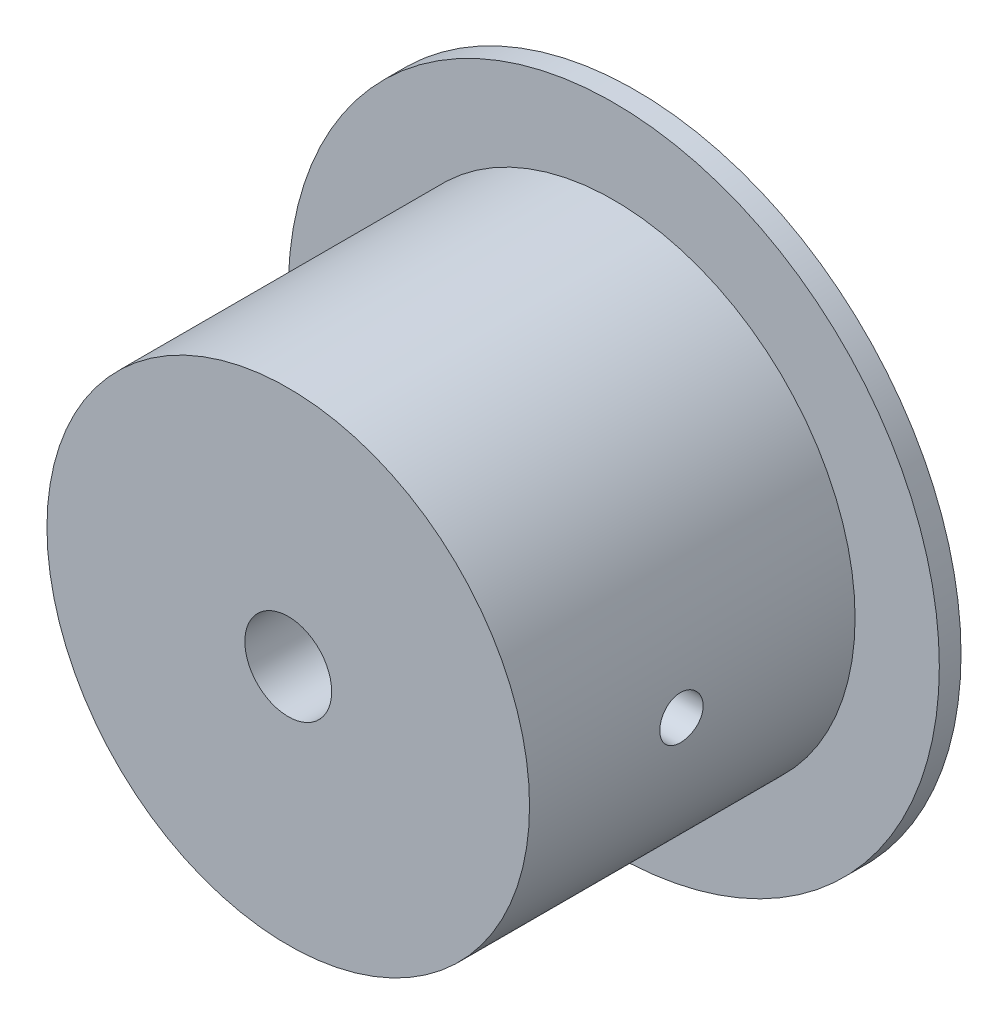
from build123d import *

# Parameters (mm, degrees)
IZIM1_R                     = 15
Y_KSEKLIK_EKSTR_ZYON1_DEPTH = 1
IZIM2_R                     = 11.118013459
Y_KSEKLIK_EKSTR_ZYON2_DEPTH = 15
IZIM3_R                     = 2
KES_EKSTR_ZYON1_DEPTH       = 38.810359459
SKETCH1_R                   = 1
CUT_EXTRUDE1_DEPTH          = 38.810359459


with BuildPart() as part:
    # Çizim1 → Yükseklik-Ekstrüzyon1 (new body)
    with BuildSketch(Plane.XY):
        with Locations((-15.799728609, 0)):
            Circle(IZIM1_R)
    extrude(amount=Y_KSEKLIK_EKSTR_ZYON1_DEPTH)

    # Çizim2 → Yükseklik-Ekstrüzyon2 (add)
    with BuildSketch(Plane.XY.offset(1)):
        with Locations((-15.799728609, 0)):
            Circle(IZIM2_R)
    extrude(amount=Y_KSEKLIK_EKSTR_ZYON2_DEPTH)

    # Çizim3 → Kes-Ekstrüzyon1 (cut, through all)
    with BuildSketch(Plane.XY.offset(16)):
        with Locations((-15.799728609, 0)):
            Circle(IZIM3_R)
    extrude(amount=-KES_EKSTR_ZYON1_DEPTH, mode=Mode.SUBTRACT)

    # Sketch1 → Cut-Extrude1 (cut, through all)
    with BuildSketch(Plane(origin=(0, 0, 0), x_dir=(0, 0, -1), z_dir=(1, 0, 0))):
        with Locations((-9, 0)):
            Circle(SKETCH1_R)
    extrude(amount=-CUT_EXTRUDE1_DEPTH, mode=Mode.SUBTRACT)


solid = part.part
